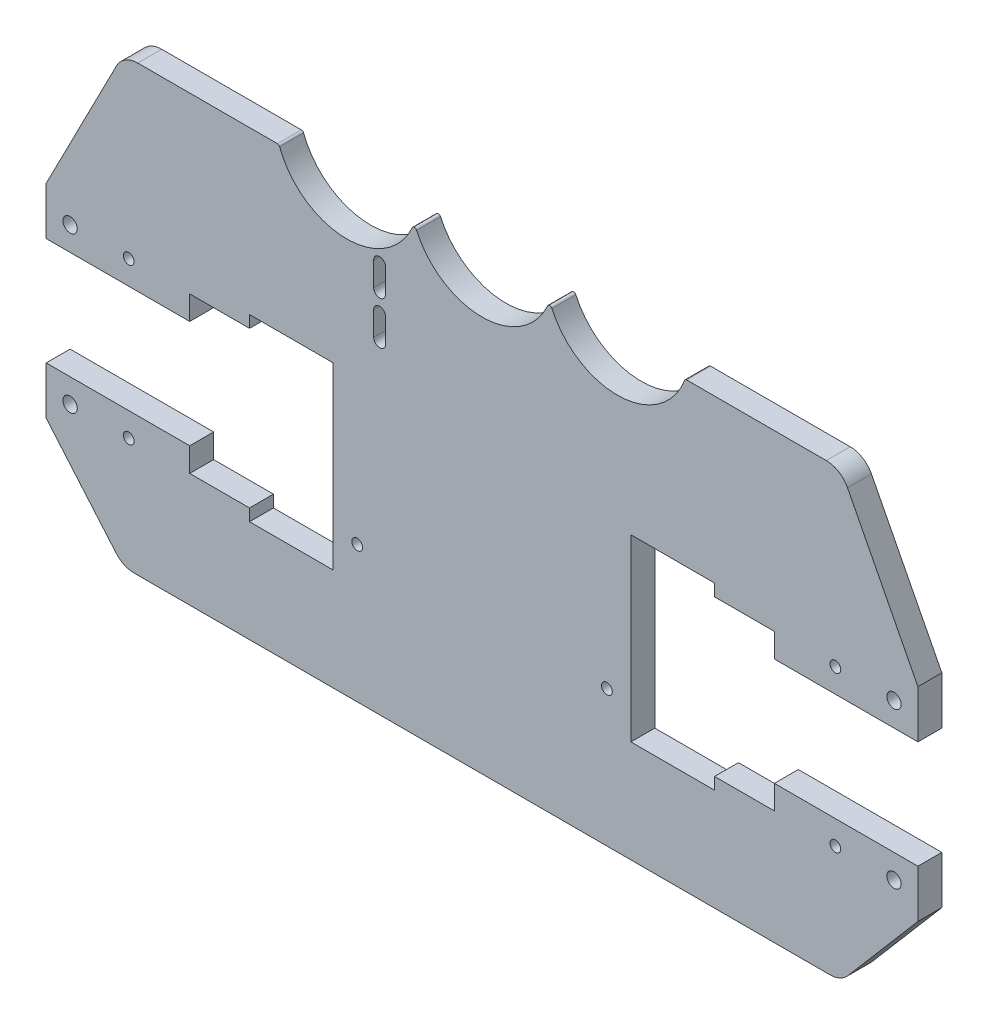
from build123d import *

# Parameters (mm, degrees)
ESQUISSE3_W                  = 364.4
ESQUISSE3_H                  = 85
ESQUISSE3_W_2                = 300
ESQUISSE3_H_2                = 62.7
ESQUISSE3_H_3                = 37.7
BOSS_EXTRU_1_DEPTH           = 10
ENL_V_MAT_EXTRU_1_DEPTH      = 10
ENL_V_MAT_EXTRU_2_DEPTH      = 211.627348652
ENL_V_MAT_EXTRU_2_DEPTH_BACK = 10
ESQUISSE10_R                 = 2.25
ESQUISSE10_R_2               = 3
ENL_V_MAT_EXTRU_3_DEPTH      = 10
ESQUISSE15_R                 = 2.25
ENL_V_MAT_EXTRU_4_DEPTH      = 10
CONG_1_R                     = 10
CONG_3_R                     = 1
ENL_V_MAT_EXTRU_5_DEPTH      = 10


with BuildPart() as part:
    # Esquisse3 → Boss.-Extru.1 (new body)
    with BuildSketch(Plane.XY):
        Rectangle(ESQUISSE3_W, ESQUISSE3_H)
        with Locations((0, 73.85)):
            Rectangle(ESQUISSE3_W_2, ESQUISSE3_H_2)
        with Locations((0, -61.35)):
            Rectangle(ESQUISSE3_W_2, ESQUISSE3_H_3)
        Polygon((-150, 105.2), (-182.2, 42.5), (-150, 42.5), align=None)
        Polygon((-150, -42.5), (-182.2, -42.5), (-150, -80.2), align=None)
        Polygon((182.2, -42.5), (150, -42.5), (150, -80.2), align=None)
        Polygon((182.2, 42.5), (150, 105.2), (150, 42.5), align=None)
    extrude(amount=BOSS_EXTRU_1_DEPTH)

    # Esquisse4 → Enlèv. mat.-Extru.1 (cut)
    with BuildSketch(Plane.XY.offset(10)):
        Polygon((-97.2, 32.5), (-122.2, 32.5), (-122.2, 22.5), (-182.2, 22.5), (-182.2, -22.5), (-122.2, -22.5), (-122.2, -32.5), (-97.2, -32.5), (-97.2, -37.5), (-62.2, -37.5), (-62.2, 37.5), (-97.2, 37.5), align=None)
        Polygon((122.2, 22.5), (122.2, 32.5), (97.2, 32.5), (97.2, 37.5), (62.2, 37.5), (62.2, -37.5), (97.2, -37.5), (97.2, -32.5), (122.2, -32.5), (122.2, -22.5), (182.2, -22.5), (182.2, 22.5), align=None)
    extrude(amount=-ENL_V_MAT_EXTRU_1_DEPTH, mode=Mode.SUBTRACT)

    # Esquisse5 → Enlèv. mat.-Extru.2 (cut, two sides: drawn at the far end of the back side and taken through both)
    with BuildSketch(Plane.XY.offset(10).offset(-ENL_V_MAT_EXTRU_2_DEPTH_BACK)):
        with BuildLine():
            Line((84.852813742, 105.2), (28.284271247, 105.2))
            ThreePointArc((28.284271247, 105.2), (56.568542495, 85.2), (84.852813742, 105.2))
        make_face()
        with BuildLine():
            ThreePointArc((-28.284271247, 105.2), (0, 85.2), (28.284271247, 105.2))
            Line((28.284271247, 105.2), (-28.284271247, 105.2))
        make_face()
        with BuildLine():
            ThreePointArc((-84.852813742, 105.2), (-56.568542495, 85.2), (-28.284271247, 105.2))
            Line((-28.284271247, 105.2), (-84.852813742, 105.2))
        make_face()
    extrude(amount=ENL_V_MAT_EXTRU_2_DEPTH + ENL_V_MAT_EXTRU_2_DEPTH_BACK, mode=Mode.SUBTRACT)

    # Esquisse10 → Enlèv. mat.-Extru.3 (cut)
    with BuildSketch(Plane.XY.offset(10)):
        with Locations((-147.7, 32.5)):
            Circle(ESQUISSE10_R)
        with Locations((-172.2, 32.5)):
            Circle(ESQUISSE10_R_2)
        with Locations((-172.2, -32.5)):
            Circle(ESQUISSE10_R_2)
        with Locations((-147.7, -32.5)):
            Circle(ESQUISSE10_R)
        with Locations((172.2, 32.5)):
            Circle(ESQUISSE10_R_2)
        with Locations((147.7, 32.5)):
            Circle(ESQUISSE10_R)
        with Locations((172.2, -32.5)):
            Circle(ESQUISSE10_R_2)
        with Locations((147.7, -32.5)):
            Circle(ESQUISSE10_R)
    extrude(amount=-ENL_V_MAT_EXTRU_3_DEPTH, mode=Mode.SUBTRACT)

    # Esquisse15 → Enlèv. mat.-Extru.4 (cut)
    with BuildSketch(Plane.XY.offset(10)):
        with Locations((-52.2, -23.2)):
            Circle(ESQUISSE15_R)
        with Locations((52.2, -23.2)):
            Circle(ESQUISSE15_R)
    extrude(amount=-ENL_V_MAT_EXTRU_4_DEPTH, mode=Mode.SUBTRACT)

    # Congé1
    cong_1_edges = [part.edges().sort_by_distance(p)[0] for p in [
        (150, -80.2, 5),
        (-150, -80.2, 5),
        (-150, 105.2, 5),
        (150, 105.2, 5),
    ]]
    fillet(cong_1_edges, radius=CONG_1_R)

    # Congé3
    cong_3_edges = [part.edges().sort_by_distance(p)[0] for p in [
        (-84.852813742, 105.2, 5),
        (84.852813742, 105.2, 5),
        (28.284271247, 105.2, 5),
        (-28.284271247, 105.2, 5),
    ]]
    fillet(cong_3_edges, radius=CONG_3_R)

    # Esquisse17 → Enlèv. mat.-Extru.5 (cut)
    with BuildSketch(Plane.XY.offset(10)):
        with BuildLine():
            Line((-40.31, 83.2), (-40.31, 73.2))
            ThreePointArc((-40.31, 73.2), (-42.81, 70.7), (-45.31, 73.2))
            Line((-45.31, 73.2), (-45.31, 83.2))
            ThreePointArc((-45.31, 83.2), (-42.81, 85.7), (-40.31, 83.2))
        make_face()
        with BuildLine():
            Line((-40.31, 65.2), (-40.31, 55.2))
            ThreePointArc((-40.31, 55.2), (-42.81, 52.7), (-45.31, 55.2))
            Line((-45.31, 55.2), (-45.31, 65.2))
            ThreePointArc((-45.31, 65.2), (-42.81, 67.7), (-40.31, 65.2))
        make_face()
    extrude(amount=-ENL_V_MAT_EXTRU_5_DEPTH, mode=Mode.SUBTRACT)


solid = part.part
